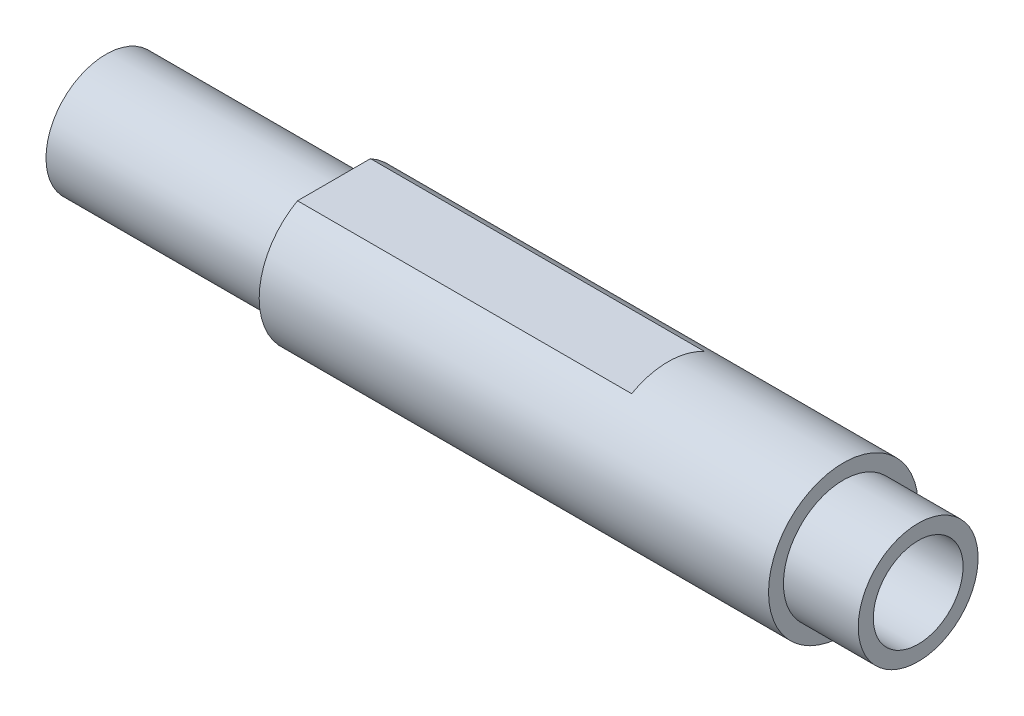
from build123d import *

# Parameters (mm, degrees)
SKETCH8_R          = 1.5
CUT_EXTRUDE2_DEPTH = 10
SKETCH9_R          = 3.17
CUT_EXTRUDE3_DEPTH = 7
SKETCH10_R         = 3
CUT_EXTRUDE4_DEPTH = 32.5
SKETCH12_W         = 24.803289192
SKETCH12_H         = 5.136244689
CUT_EXTRUDE5_DEPTH = 12.7


with BuildPart() as part:
    # Sketch6 → Revolve1 (revolve)
    with BuildSketch(Plane.XY, mode=Mode.PRIVATE) as revolve1_sk:
        Polygon((-38.276, 0), (-38.276, 4.005), (-23.036, 4.005), (-23.036, 5), (11, 5), (11, 4.005), (16, 4.005), (16, 0), align=None)
    revolve(revolve1_sk.sketch.rotate(Axis((-1000, 0, 0), (1, 0, 0)), 90), axis=Axis((-1000, 0, 0), (1, 0, 0)))

    # Sketch8 → Cut-Extrude2 (cut)
    with BuildSketch(Plane(origin=(0, 0, 0), x_dir=(1, 0, 0), z_dir=(0, 1, 0))):
        with Locations(Location((-35.276, 0, 0), (0, 0, 270))):
            Circle(SKETCH8_R)
    extrude(amount=-CUT_EXTRUDE2_DEPTH, mode=Mode.SUBTRACT)

    # Sketch9 → Cut-Extrude3 (cut)
    with BuildSketch(Plane.ZY.offset(38.276)):
        Circle(SKETCH9_R)
    extrude(amount=-CUT_EXTRUDE3_DEPTH, mode=Mode.SUBTRACT)

    # Sketch10 → Cut-Extrude4 (cut)
    with BuildSketch(Plane(origin=(16, 0, 0), x_dir=(0, 0, -1), z_dir=(1, 0, 0))):
        Circle(SKETCH10_R)
    extrude(amount=-CUT_EXTRUDE4_DEPTH, mode=Mode.SUBTRACT)

    # Sketch12 → Cut-Extrude5 (cut, symmetric)
    with BuildSketch(Plane.XY):
        with Locations((-13.109401935, 6.933122345)):
            Rectangle(SKETCH12_W, SKETCH12_H)
    extrude(amount=CUT_EXTRUDE5_DEPTH, both=True, mode=Mode.SUBTRACT)


solid = part.part
